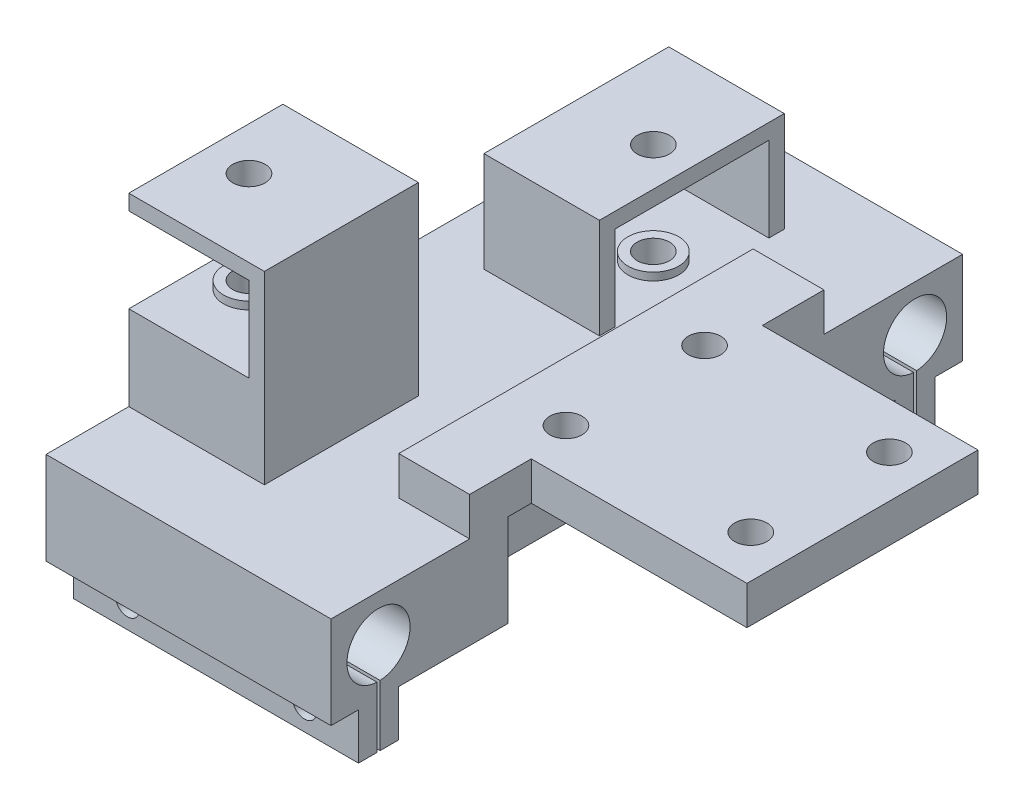
from build123d import *

# Parameters (mm, degrees)
SKETCH1_W            = 35
SKETCH1_H            = 30
SKETCH1_R            = 2.1
BOSS_EXTRUDE1_DEPTH  = 5
SKETCH2_W            = 30
SKETCH2_H            = 17
BOSS_EXTRUDE2_DEPTH  = 5
BOSS_EXTRUDE3_START  = -28
BOSS_EXTRUDE3_DEPTH  = 37
CUT_EXTRUDE1_REACH   = 66.542
CUT_EXTRUDE1_START   = -4.5
SKETCH5_W            = 36
SKETCH5_H            = 12.013565991
SKETCH6_W            = 2.1
SKETCH6_H            = 35.25
CUT_EXTRUDE2_DEPTH   = 5
SKETCH9_W            = 9.9
SKETCH9_H            = 8
BOSS_EXTRUDE5_DEPTH  = 5
SKETCH10_W           = 0.7
SKETCH10_H           = 46
CUT_EXTRUDE4_DEPTH   = 5
CUT_EXTRUDE5_REACH   = 68.83
SKETCH7_R            = 2.1
SKETCH11_W           = 17.6
SKETCH11_H           = 20
SKETCH11_W_2         = 15
SKETCH11_H_2         = 2
BOSS_EXTRUDE6_DEPTH  = 11
SKETCH12_W           = 15
SKETCH12_H           = 24
BOSS_EXTRUDE8_DEPTH  = 2
SKETCH13_W           = 2
SKETCH13_H           = 20
BOSS_EXTRUDE9_DEPTH  = 11
SKETCH14_W           = 17.6
SKETCH14_H           = 20
BOSS_EXTRUDE10_DEPTH = 2
CUT_EXTRUDE6_START   = -36
SKETCH15_R           = 2.1
CUT_EXTRUDE6_DEPTH   = 36
SKETCH16_R           = 4
SKETCH16_R_2         = 4.5
CUT_EXTRUDE7_DEPTH   = 8
BOSS_EXTRUDE11_START = -2
SKETCH17_R           = 3.3
SKETCH17_R_2         = 2.1
BOSS_EXTRUDE11_DEPTH = 1
BOSS_EXTRUDE12_START = -12
SKETCH17_2_R         = 3.3
SKETCH17_2_R_2       = 2.1
BOSS_EXTRUDE12_DEPTH = 1
BOSS_EXTRUDE13_START = -2
SKETCH18_R           = 3.3
SKETCH18_R_2         = 2.1
BOSS_EXTRUDE13_DEPTH = 1
BOSS_EXTRUDE14_START = -12
SKETCH18_2_R         = 3.3
SKETCH18_2_R_2       = 2.1
BOSS_EXTRUDE14_DEPTH = 1
SKETCH19_R           = 1.55
CUT_EXTRUDE8_DEPTH   = 95.781405877


with BuildPart() as part:
    # Sketch1 → Boss-Extrude1 (new body)
    with BuildSketch(Plane(origin=(0, 0, 0), x_dir=(1, 0, 0), z_dir=(0, 1, 0))):
        Rectangle(SKETCH1_W, SKETCH1_H)
        with Locations(Location((12, 9, 0), (0, 0, 270))):
            Circle(SKETCH1_R, mode=Mode.SUBTRACT)
        with Locations(Location((12, -9, 0), (0, 0, 90))):
            Circle(SKETCH1_R, mode=Mode.SUBTRACT)
        with Locations(Location((-12, -9, 0), (0, 0, 270))):
            Circle(SKETCH1_R, mode=Mode.SUBTRACT)
        with Locations(Location((-12, 9, 0), (0, 0, 90))):
            Circle(SKETCH1_R, mode=Mode.SUBTRACT)
    extrude(amount=BOSS_EXTRUDE1_DEPTH)

    # Sketch2 → Boss-Extrude2 (add)
    with BuildSketch(Plane.ZY.offset(17.5)):
        with Locations((0, -3.5)):
            Rectangle(SKETCH2_W, SKETCH2_H)
    extrude(amount=BOSS_EXTRUDE2_DEPTH)

    # Sketch3 → Boss-Extrude3 (add)
    with BuildSketch(Plane(origin=(17.5, 0, 0), x_dir=(0, 0, -1), z_dir=(1, 0, 0)).offset(BOSS_EXTRUDE3_START)):
        with BuildLine():
            Line((-41, 0), (41, 0))
            Line((41, 0), (41, -12))
            Line((41, -12), (37.43, -12))
            Line((37.43, -12), (37.43, -18))
            Line((37.43, -18), (35.03, -18))
            Line((35.03, -18), (35.03, -12))
            Line((35.03, -12), (35.03, -10.095119046))
            ThreePointArc((35.03, -10.095119046), (34.83, -1.9), (34.63, -10.095119046))
            Line((34.63, -10.095119046), (34.63, -12))
            Line((34.63, -12), (34.63, -18))
            Line((34.63, -18), (32.23, -18))
            Line((32.23, -18), (32.23, -12))
            Line((32.23, -12), (-32.23, -12))
            Line((-32.23, -12), (-32.23, -18))
            Line((-32.23, -18), (-34.63, -18))
            Line((-34.63, -18), (-34.63, -12))
            Line((-34.63, -12), (-34.63, -10.095119046))
            ThreePointArc((-34.63, -10.095119046), (-34.83, -1.9), (-35.03, -10.095119046))
            Line((-35.03, -10.095119046), (-35.03, -12))
            Line((-35.03, -12), (-35.03, -18))
            Line((-35.03, -18), (-37.43, -18))
            Line((-37.43, -18), (-37.43, -12))
            Line((-37.43, -12), (-41, -12))
            Line((-41, -12), (-41, 0))
        make_face()
    extrude(amount=-BOSS_EXTRUDE3_DEPTH)

    # Sketch5 → Cut-Extrude1 (cut, up to next)
    with BuildSketch(Plane.ZY.offset(22.5).offset(CUT_EXTRUDE1_START), mode=Mode.PRIVATE) as cut_extrude1_sk1:
        with Locations((0, -5.993217004)):
            Rectangle(SKETCH5_W, SKETCH5_H)
    cut_extrude1_tool1 = extrude(cut_extrude1_sk1.sketch, amount=-CUT_EXTRUDE1_REACH, mode=Mode.PRIVATE) & part.part
    add(cut_extrude1_tool1.solids().sort_by_distance((-18, -5.993217, 0))[0], mode=Mode.SUBTRACT)

    # Sketch6 → Cut-Extrude2 (cut)
    with BuildSketch(Plane(origin=(0, 5, 0), x_dir=(1, 0, 0), z_dir=(0, 1, 0))):
        with Locations((-21.45, -2.625)):
            Rectangle(SKETCH6_W, SKETCH6_H)
    extrude(amount=-CUT_EXTRUDE2_DEPTH, mode=Mode.SUBTRACT)

    # Sketch9 → Boss-Extrude5 (add)
    with BuildSketch(Plane(origin=(0, 0, 0), x_dir=(1, 0, 0), z_dir=(0, 1, 0))):
        with Locations((-15.45, 19)):
            Rectangle(SKETCH9_W, SKETCH9_H)
        with Locations((-15.45, -19)):
            Rectangle(SKETCH9_W, SKETCH9_H)
    extrude(amount=BOSS_EXTRUDE5_DEPTH)

    # Sketch10 → Cut-Extrude4 (cut)
    with BuildSketch(Plane(origin=(0, 5, 0), x_dir=(1, 0, 0), z_dir=(0, 1, 0))):
        with Locations((-20.05, 0)):
            Rectangle(SKETCH10_W, SKETCH10_H)
    extrude(amount=-CUT_EXTRUDE4_DEPTH, mode=Mode.SUBTRACT)

    # Sketch7 → Cut-Extrude5 (cut, up to next)
    with BuildSketch(Plane(origin=(0, 5, 0), x_dir=(1, 0, 0), z_dir=(0, 1, 0)), mode=Mode.PRIVATE) as cut_extrude5_sk1:
        with Locations(Location((-41.9, -20.25, 0), (0, 0, 270))):
            Circle(SKETCH7_R)
    cut_extrude5_tool1 = extrude(cut_extrude5_sk1.sketch, amount=-CUT_EXTRUDE5_REACH, mode=Mode.PRIVATE) & part.part
    # Sketch7 → Cut-Extrude5 (cut, up to next)
    with BuildSketch(Plane(origin=(0, 5, 0), x_dir=(1, 0, 0), z_dir=(0, 1, 0)), mode=Mode.PRIVATE) as cut_extrude5_sk2:
        with Locations(Location((-29.9, 20.25, 0), (0, 0, 270))):
            Circle(SKETCH7_R)
    cut_extrude5_tool2 = extrude(cut_extrude5_sk2.sketch, amount=-CUT_EXTRUDE5_REACH, mode=Mode.PRIVATE) & part.part
    add(cut_extrude5_tool1.solids().sort_by_distance((-41.9, 5, 20.25))[0], mode=Mode.SUBTRACT)
    add(cut_extrude5_tool2.solids().sort_by_distance((-29.9, 5, -20.25))[0], mode=Mode.SUBTRACT)

    # Sketch11 → Boss-Extrude6 (add)
    with BuildSketch(Plane(origin=(0, 0, 0), x_dir=(1, 0, 0), z_dir=(0, 1, 0))):
        with Locations((-38.7, -20.25)):
            Rectangle(SKETCH11_W, SKETCH11_H)
        with Locations((-32.4, 31.25)):
            Rectangle(SKETCH11_W_2, SKETCH11_H_2)
        with Locations((-32.4, 9.25)):
            Rectangle(SKETCH11_W_2, SKETCH11_H_2)
    extrude(amount=BOSS_EXTRUDE6_DEPTH)

    # Sketch12 → Boss-Extrude8 (add)
    with BuildSketch(Plane(origin=(0, 11, 0), x_dir=(1, 0, 0), z_dir=(0, 1, 0))):
        with Locations((-32.4, 20.25)):
            Rectangle(SKETCH12_W, SKETCH12_H)
    extrude(amount=BOSS_EXTRUDE8_DEPTH)

    # Sketch13 → Boss-Extrude9 (add)
    with BuildSketch(Plane(origin=(0, 11, 0), x_dir=(1, 0, 0), z_dir=(0, 1, 0))):
        with Locations((-30.9, -20.25)):
            Rectangle(SKETCH13_W, SKETCH13_H)
    extrude(amount=BOSS_EXTRUDE9_DEPTH)

    # Sketch14 → Boss-Extrude10 (add)
    with BuildSketch(Plane(origin=(0, 22, 0), x_dir=(1, 0, 0), z_dir=(0, 1, 0))):
        with Locations((-38.7, -20.25)):
            Rectangle(SKETCH14_W, SKETCH14_H)
    extrude(amount=BOSS_EXTRUDE10_DEPTH)

    # Sketch15 → Cut-Extrude6 (cut)
    with BuildSketch(Plane.XZ.offset(12).offset(CUT_EXTRUDE6_START)):
        with Locations(Location((-29.9, -20.25, 0), (0, 0, 90))):
            Circle(SKETCH15_R)
        with Locations(Location((-41.9, 20.25, 0), (0, 0, 90))):
            Circle(SKETCH15_R)
    extrude(amount=CUT_EXTRUDE6_DEPTH, mode=Mode.SUBTRACT)

    # Sketch16 → Cut-Extrude7 (cut)
    with BuildSketch(Plane.XZ.offset(12)):
        with Locations(Location((-41.9, 20.25, 0), (0, 0, 270))):
            Circle(SKETCH16_R)
        with Locations(Location((-29.9, -20.25, 0), (0, 0, 270))):
            Circle(SKETCH16_R_2)
    extrude(amount=-CUT_EXTRUDE7_DEPTH, mode=Mode.SUBTRACT)

    # Sketch17 → Boss-Extrude11 (add)
    with BuildSketch(Plane(origin=(0, 24, 0), x_dir=(1, 0, 0), z_dir=(0, 1, 0)).offset(BOSS_EXTRUDE11_START)):
        with Locations(Location((-41.9, -20.25, 0), (0, 0, 270))):
            Circle(SKETCH17_R)
        with Locations(Location((-41.9, -20.25, 0), (0, 0, 90))):
            Circle(SKETCH17_R_2, mode=Mode.SUBTRACT)
    extrude(amount=-BOSS_EXTRUDE11_DEPTH)

    # Sketch17<2> → Boss-Extrude12 (add)
    with BuildSketch(Plane(origin=(0, 24, 0), x_dir=(1, 0, 0), z_dir=(0, 1, 0)).offset(BOSS_EXTRUDE12_START)):
        with Locations(Location((-41.9, -20.25, 0), (0, 0, 270))):
            Circle(SKETCH17_2_R)
        with Locations(Location((-41.9, -20.25, 0), (0, 0, 90))):
            Circle(SKETCH17_2_R_2, mode=Mode.SUBTRACT)
    extrude(amount=-BOSS_EXTRUDE12_DEPTH)

    # Sketch18 → Boss-Extrude13 (add)
    with BuildSketch(Plane(origin=(0, 13, 0), x_dir=(1, 0, 0), z_dir=(0, 1, 0)).offset(BOSS_EXTRUDE13_START)):
        with Locations(Location((-29.9, 20.25, 0), (0, 0, 270))):
            Circle(SKETCH18_R)
        with Locations(Location((-29.9, 20.25, 0), (0, 0, 90))):
            Circle(SKETCH18_R_2, mode=Mode.SUBTRACT)
    extrude(amount=-BOSS_EXTRUDE13_DEPTH)

    # Sketch18<2> → Boss-Extrude14 (add)
    with BuildSketch(Plane(origin=(0, 13, 0), x_dir=(1, 0, 0), z_dir=(0, 1, 0)).offset(BOSS_EXTRUDE14_START)):
        with Locations(Location((-29.9, 20.25, 0), (0, 0, 270))):
            Circle(SKETCH18_2_R)
        with Locations(Location((-29.9, 20.25, 0), (0, 0, 90))):
            Circle(SKETCH18_2_R_2, mode=Mode.SUBTRACT)
    extrude(amount=-BOSS_EXTRUDE14_DEPTH)

    # Sketch19 → Cut-Extrude8 (cut, through all)
    with BuildSketch(Plane.XY.offset(37.43)):
        with Locations((-40.5, -15)):
            Circle(SKETCH19_R)
        with Locations((-17.5, -15)):
            Circle(SKETCH19_R)
    extrude(amount=-CUT_EXTRUDE8_DEPTH, mode=Mode.SUBTRACT)


solid = part.part
